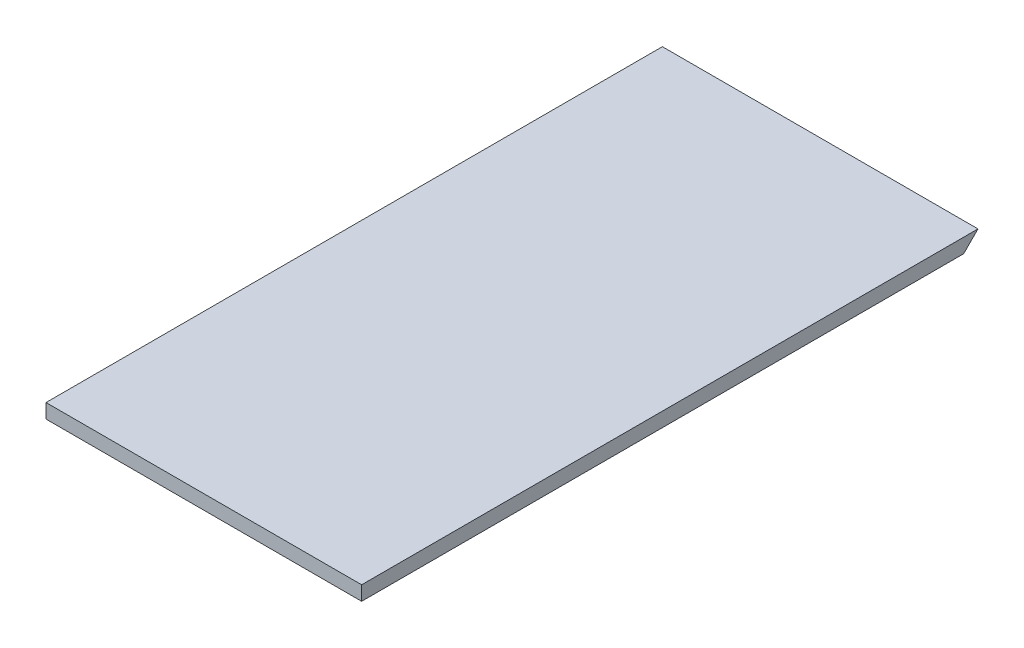
from build123d import *

# Parameters (mm, degrees)
BOSS_EXTRUDE1_DEPTH = 279.4


with BuildPart() as part:
    # Sketch1 → Boss-Extrude1 (new body)
    with BuildSketch(Plane(origin=(0, 0, 0), x_dir=(0, 0, -1), z_dir=(1, 0, 0))):
        Polygon((0, 0), (0, 12.7), (545.592, 12.7), (532.892, 0), align=None)
    extrude(amount=BOSS_EXTRUDE1_DEPTH)


solid = part.part
